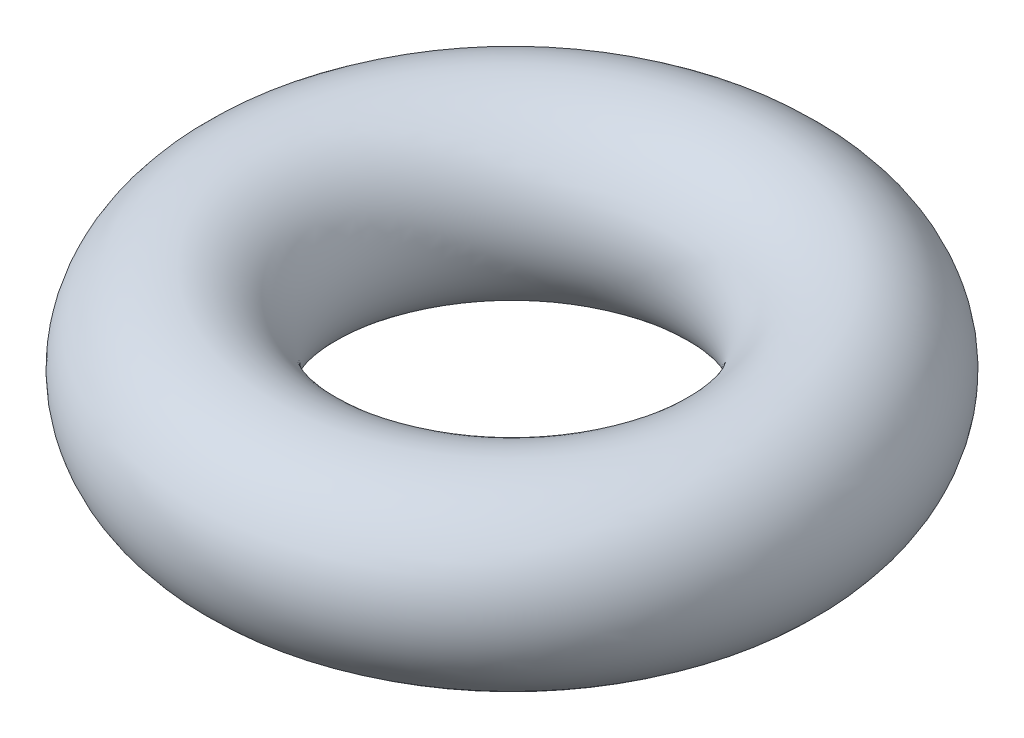
from build123d import *

# Parameters (mm, degrees)
SKETCH2_R = 19.05


with BuildPart() as part:
    # Sketch2 → Revolve1 (revolve)
    with BuildSketch(Plane.XY, mode=Mode.PRIVATE) as revolve1_sk:
        with Locations((-50.8, 0)):
            Circle(SKETCH2_R)
    revolve(revolve1_sk.sketch.rotate(Axis((0, 87.442723002, 0), (0, -1, 0)), 270), axis=Axis((0, 87.442723002, 0), (0, -1, 0)))


solid = part.part
